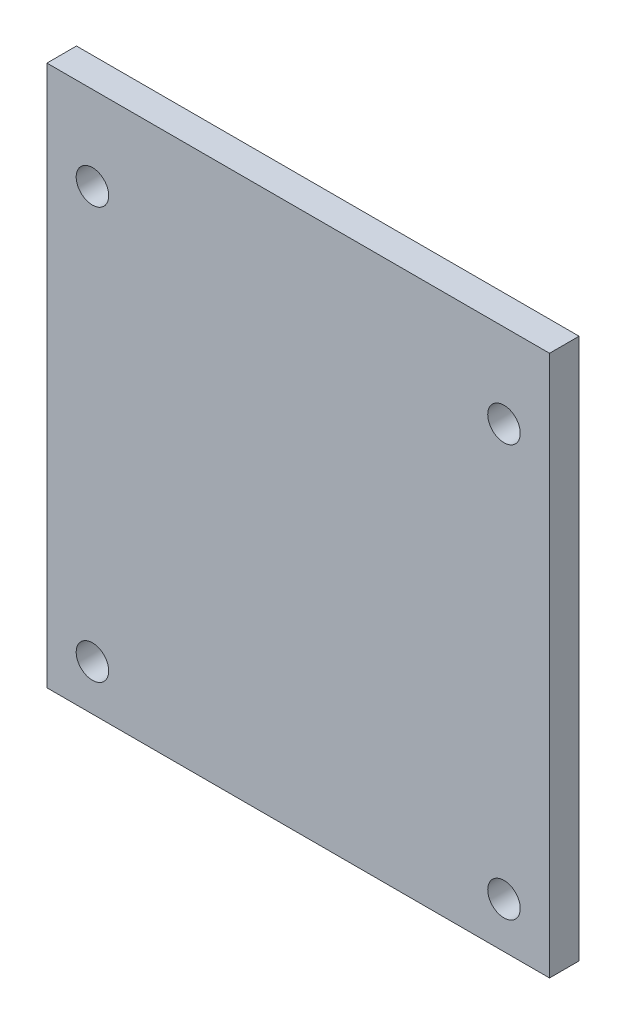
from build123d import *

# Parameters (mm, degrees)
SKETCH_2_W          = 85
SKETCH_2_H          = 91.5
EXTRUDE_1_DEPTH     = 5
SKETCH_7_R          = 2.75
CUT_EXTRUDE_2_DEPTH = 121.312094155


with BuildPart() as part:
    # Эскиз2 → Вытянуть1 (new body)
    with BuildSketch(Plane.XY):
        with Locations((42.5, -39.25)):
            Rectangle(SKETCH_2_W, SKETCH_2_H)
    extrude(amount=EXTRUDE_1_DEPTH)

    # Эскиз7 → Вырез-Вытянуть2 (cut, through all)
    with BuildSketch(Plane(origin=(0, 0, 0), x_dir=(-1, 0, 0), z_dir=(0, 0, -1))):
        with Locations((-7.7, -77.3)):
            Circle(SKETCH_7_R)
        with Locations((-77.3, -77.3)):
            Circle(SKETCH_7_R)
        with Locations((-77.3, -7.7)):
            Circle(SKETCH_7_R)
        with Locations((-7.7, -7.7)):
            Circle(SKETCH_7_R)
    extrude(amount=-CUT_EXTRUDE_2_DEPTH, mode=Mode.SUBTRACT)


solid = part.part
